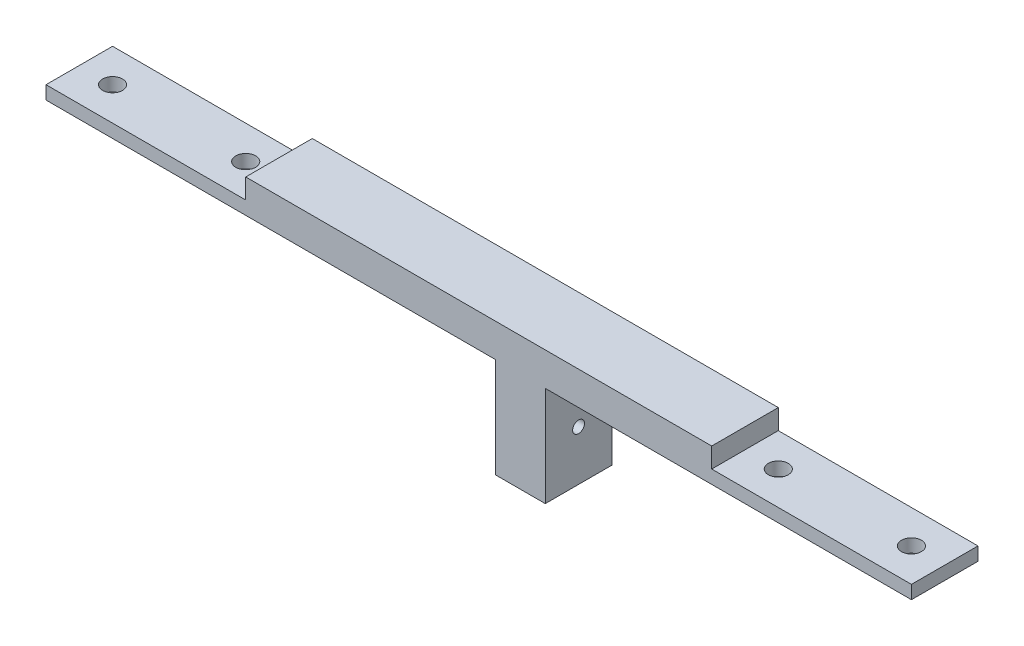
from build123d import *

# Parameters (mm, degrees)
SKETCH1_W             = 165.1
SKETCH1_H             = 12.7
BOSS_EXTRUDE1_DEPTH   = 6.35
SKETCH2_W             = 38.1
SKETCH2_H             = 3.81
CUT_EXTRUDE1_DEPTH    = 84.762252835
F_6_CLEARANCE_HOLE1_D = 3.7973
SKETCH6_W             = 9.525
SKETCH6_H             = 19.05
BOSS_EXTRUDE2_DEPTH   = 12.7
F_4_40_TAPPED_HOLE1_D = 2.2606


with BuildPart() as part:
    # Sketch1 → Boss-Extrude1 (new body)
    with BuildSketch(Plane(origin=(0, 0, 0), x_dir=(1, 0, 0), z_dir=(0, 1, 0))):
        Rectangle(SKETCH1_W, SKETCH1_H)
    extrude(amount=BOSS_EXTRUDE1_DEPTH)

    # Sketch2 → Cut-Extrude1 (cut, through all)
    with BuildSketch(Plane.XY.offset(6.35)):
        with Locations((-63.5, 4.445)):
            Rectangle(SKETCH2_W, SKETCH2_H)
    cut_extrude1 = extrude(amount=-CUT_EXTRUDE1_DEPTH, mode=Mode.SUBTRACT)

    # #6 Clearance Hole1 (through all)
    with Locations(Plane(origin=(0, 0, 0), x_dir=(-1, 0, 0), z_dir=(0, -1, 0))):
        with Locations((50.8, 0), (76.2, 0)):
            f_6_clearance_hole1 = Hole(F_6_CLEARANCE_HOLE1_D / 2)

    # Mirror1: Cut-Extrude1, #6 Clearance Hole1 across plane
    add(cut_extrude1.mirror(Plane(origin=(0, 0, 0), x_dir=(0, 0, 1), z_dir=(1, 0, 0))), mode=Mode.SUBTRACT)
    add(f_6_clearance_hole1.mirror(Plane(origin=(0, 0, 0), x_dir=(0, 0, 1), z_dir=(1, 0, 0))), mode=Mode.SUBTRACT)

    # Sketch6 → Boss-Extrude2 (add)
    with BuildSketch(Plane.XY.offset(6.35)):
        with Locations((7.9375, -9.525)):
            Rectangle(SKETCH6_W, SKETCH6_H)
    extrude(amount=-BOSS_EXTRUDE2_DEPTH)

    # #4-40 Tapped Hole1 (through all)
    with Locations(Plane(origin=(12.7, 0, 0), x_dir=(0, 0, -1), z_dir=(1, 0, 0))):
        with Locations((0, -9.525)):
            Hole(F_4_40_TAPPED_HOLE1_D / 2)


solid = part.part
